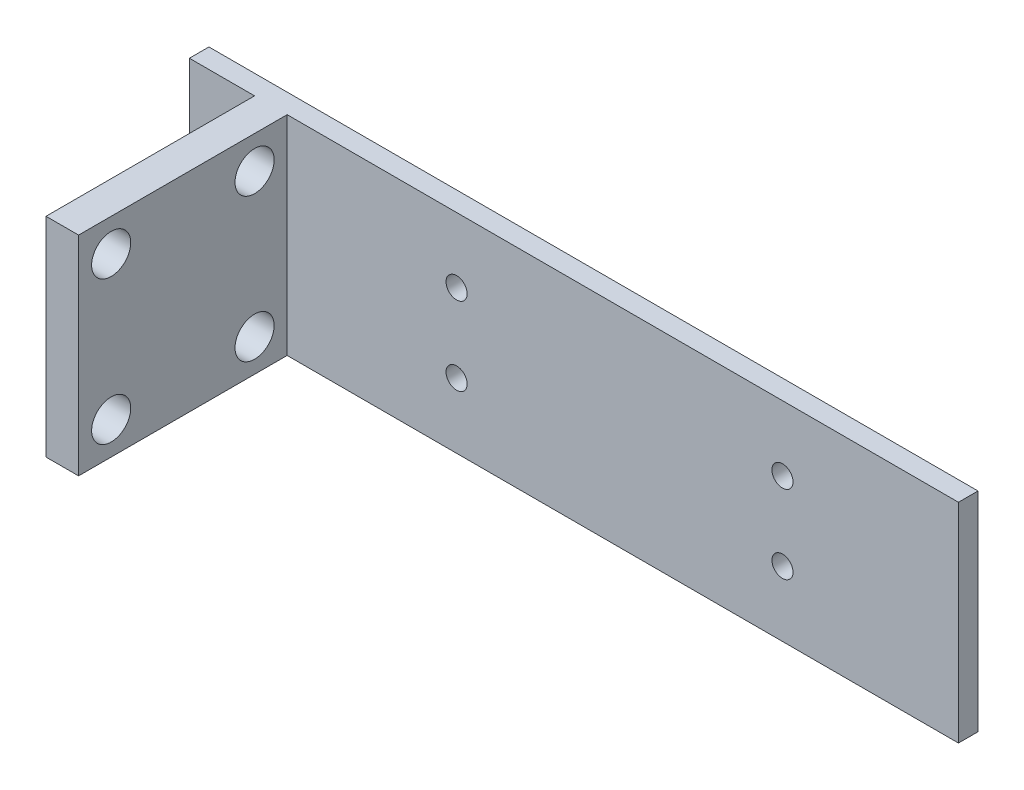
from build123d import *

# Parameters (mm, degrees)
SKETCH_1_W          = 118
SKETCH_1_H          = 32
EXTRUDE_1_DEPTH     = 3
SKETCH_2_R          = 1.62
CUT_EXTRUDE_1_DEPTH = 3
SKETCH_3_W          = 5
SKETCH_3_H          = 32
EXTRUDE_2_DEPTH     = 32
SKETCH_4_R          = 3
CUT_EXTRUDE_2_DEPTH = 32


with BuildPart() as part:
    # 草图1 → 凸台-拉伸1 (new body)
    with BuildSketch(Plane.XY):
        with Locations((-12.281632653, 6.717006803)):
            Rectangle(SKETCH_1_W, SKETCH_1_H)
    extrude(amount=EXTRUDE_1_DEPTH)

    # 草图2 → 切除-拉伸1 (cut)
    with BuildSketch(Plane.XY.offset(3)):
        with Locations((-30.281632653, 12.717006803)):
            Circle(SKETCH_2_R)
        with Locations((-30.281632653, 0.717006803)):
            Circle(SKETCH_2_R)
        with Locations((19.718367347, 12.717006803)):
            Circle(SKETCH_2_R)
        with Locations((19.718367347, 0.717006803)):
            Circle(SKETCH_2_R)
    extrude(amount=-CUT_EXTRUDE_1_DEPTH, mode=Mode.SUBTRACT)

    # 草图3 → 凸台-拉伸2 (add)
    with BuildSketch(Plane.XY.offset(3)):
        with Locations((-58.781632653, 6.717006803)):
            Rectangle(SKETCH_3_W, SKETCH_3_H)
    extrude(amount=EXTRUDE_2_DEPTH)

    # 草图4 → 切除-拉伸2 (cut)
    with BuildSketch(Plane.ZY.offset(71.281632653)):
        with Locations((30, 17.717006803)):
            Circle(SKETCH_4_R)
        with Locations((30, -4.282993197)):
            Circle(SKETCH_4_R)
        with Locations((8, 17.717006803)):
            Circle(SKETCH_4_R)
        with Locations((8, -4.282993197)):
            Circle(SKETCH_4_R)
    extrude(amount=-CUT_EXTRUDE_2_DEPTH, mode=Mode.SUBTRACT)


solid = part.part
